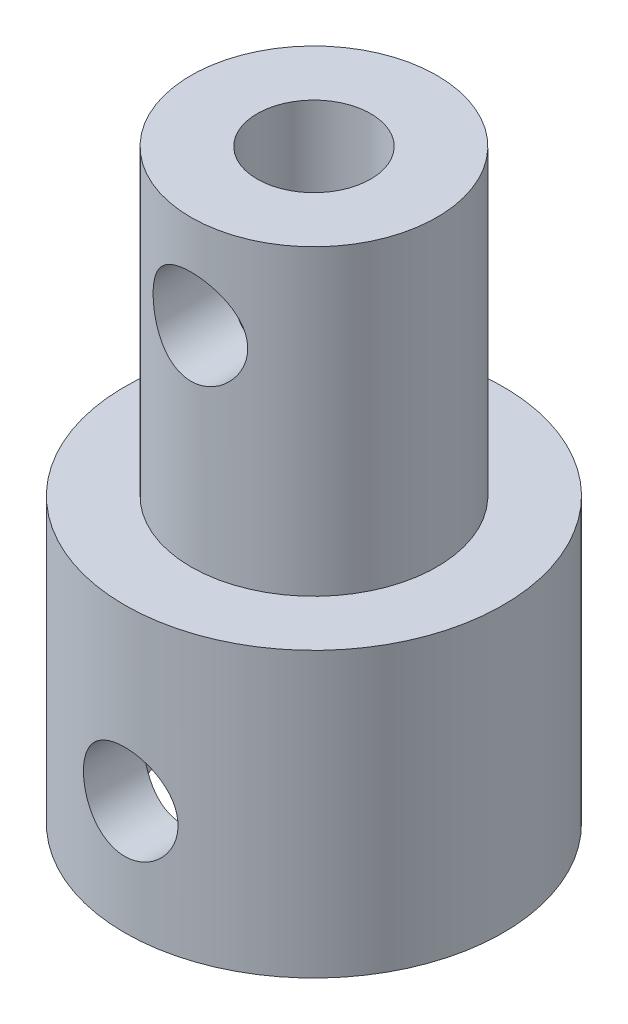
from build123d import *

# Parameters (mm, degrees)
TROU_TARAUD_M14X1_51_D     = 14
TROU_TARAUD_M14X1_51_DEPTH = 12
TROU_TARAUD_M14X1_51_TIP   = 4.206024333
TROU_TARAUD_M61_AT_2_COUNT = 2
TROU_TARAUD_M61_AT_2_PITCH = 20


with BuildPart() as part:
    # Esquisse1 → Révolution1 (revolve)
    with BuildSketch(Plane.XY, mode=Mode.PRIVATE) as r_volution1_sk:
        Polygon((-6.5, 31), (-3, 31), (-3, 0), (-10, 0), (-10, 15), (-6.5, 15), align=None)
    revolve(r_volution1_sk.sketch.rotate(Axis((0, 39.529907563, 0), (0, -1, 0)), 270), axis=Axis((0, 39.529907563, 0), (0, -1, 0)))

    # Trou taraudé M14x1.51
    with Locations(Plane(origin=(0, 0, 0), x_dir=(-1, 0, 0), z_dir=(0, -1, 0))):
        with Locations((0, 0)):
            Hole(TROU_TARAUD_M14X1_51_D / 2, depth=TROU_TARAUD_M14X1_51_DEPTH)
            with Locations((0, 0, -(TROU_TARAUD_M14X1_51_DEPTH + TROU_TARAUD_M14X1_51_TIP / 2))):  # 118° drill point
                Cone(0, TROU_TARAUD_M14X1_51_D / 2, TROU_TARAUD_M14X1_51_TIP, mode=Mode.SUBTRACT)

    # Esquisse7 → Trou taraudé M61 (revolve, cut)
    with BuildSketch(Plane(origin=(0, 6, 0), x_dir=(0, 1, 0), z_dir=(1, 0, 0))):
        Polygon((0, 0), (0, 17.502151548), (2.5, 16), (2.5, 0), align=None)
    trou_taraud_m61 = revolve(axis=Axis((0, 6, -6.35), (0, 0, 1)), mode=Mode.SUBTRACT)

    # Trou taraudé M61 at 2: Trou taraudé M61 ×2
    with Locations(*[(0, i * TROU_TARAUD_M61_AT_2_PITCH, 0) for i in range(1, TROU_TARAUD_M61_AT_2_COUNT)]):
        add(trou_taraud_m61, mode=Mode.SUBTRACT)


solid = part.part
